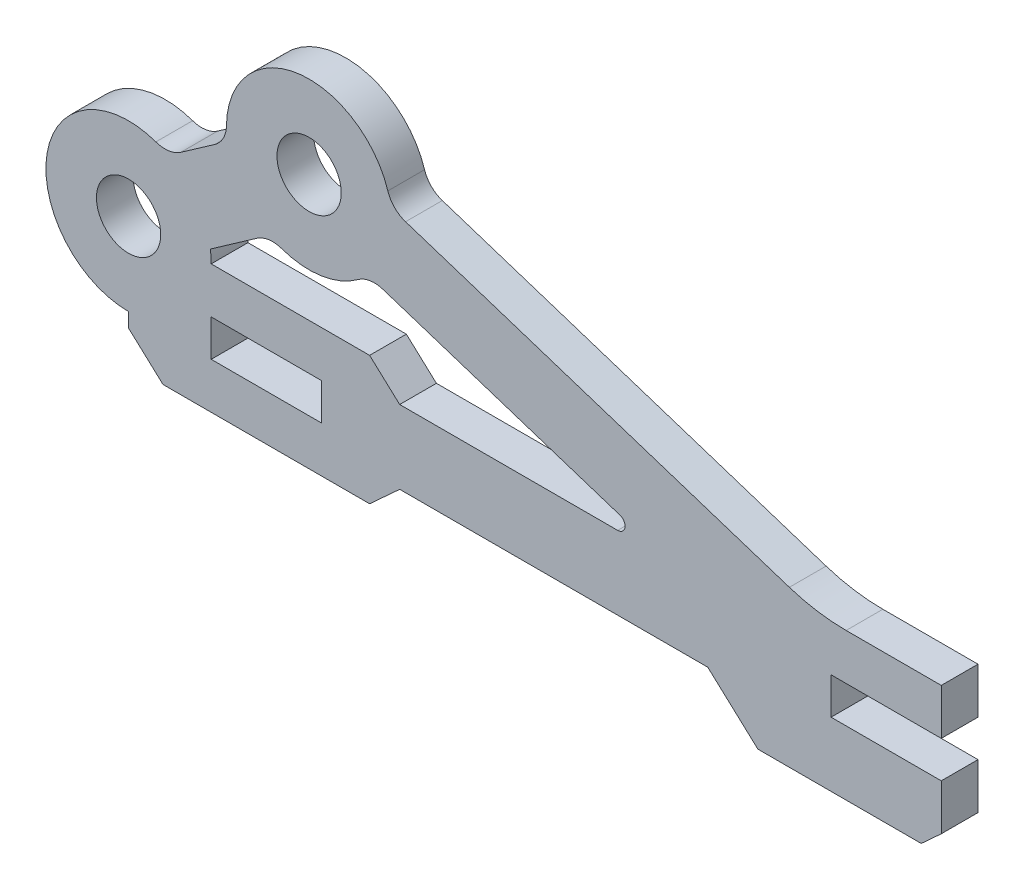
from build123d import *

# Parameters (mm, degrees)
SKETCH1_R           = 1.75
SKETCH1_W           = 6
SKETCH1_H           = 2
BOSS_EXTRUDE1_DEPTH = 2


with BuildPart() as part:
    # Sketch1 → Boss-Extrude1 (new body)
    with BuildSketch(Plane.XY):
        with BuildLine():
            Line((4.690618402, 5.725955542), (2.844900384, 4.433569872))
            ThreePointArc((2.844900384, 4.433569872), (2.189215725, 4.176328188), (1.488401797, 4.246723454))
            ThreePointArc((1.488401797, 4.246723454), (-4.436229003, 0.754898821), (0, -4.5))
            Line((0, -4.5), (0, -5.281879049))
            Line((0, -5.281879049), (1.875, -7))
            Line((1.875, -7), (13.125, -7))
            Line((13.125, -7), (14.761962752, -5.5))
            Line((14.761962752, -5.5), (31.536424497, -5.5))
            Line((31.536424497, -5.5), (34.26469575, -8))
            Line((34.26469575, -8), (43.158691499, -8))
            Line((43.158691499, -8), (44.25, -7))
            Line((44.25, -7), (44.25, -4.5))
            Line((44.25, -4.5), (38.25, -4.5))
            Line((38.25, -4.5), (38.25, -2.5))
            Line((38.25, -2.5), (44.25, -2.5))
            Line((44.25, -2.5), (44.25, 0))
            Line((44.25, 0), (39.069245955, 0))
            ThreePointArc((39.069245955, 0), (37.504901305, 0.123116594), (35.979076012, 0.489434837))
            Line((35.979076012, 0.489434837), (15.082734658, 7.279067722))
            ThreePointArc((15.082734658, 7.279067722), (14.482691436, 7.647908864), (14.117151245, 8.249968682))
            ThreePointArc((14.117151245, 8.249968682), (9.164682181, 11.333488621), (5.330146444, 6.936742015))
            ThreePointArc((5.330146444, 6.936742015), (5.156603875, 6.254115739), (4.690618402, 5.725955542))
        make_face()
        Circle(SKETCH1_R, mode=Mode.SUBTRACT)
        with Locations((9.829824531, 6.882917236)):
            Circle(SKETCH1_R, mode=Mode.SUBTRACT)
        with Locations((7.5, -3.5)):
            Rectangle(SKETCH1_W, SKETCH1_H, mode=Mode.SUBTRACT)
        with BuildLine():
            Line((13.84666668, 3.474841657), (26.75576114, -0.719577393))
            ThreePointArc((26.75576114, -0.719577393), (27.027229678, -1.162573786), (26.632154342, -1.5))
            Line((26.632154342, -1.5), (14.761962752, -1.5))
            Line((14.761962752, -1.5), (13.125, 0))
            Line((13.125, 0), (4.5, 0))
            ThreePointArc((4.5, 0), (4.487297154, 0.337882015), (4.449260331, 0.673856446))
            Line((4.449260331, 0.673856446), (6.984924148, 2.449347365))
            ThreePointArc((6.984924148, 2.449347365), (7.640608806, 2.706589049), (8.341422735, 2.636193783))
            ThreePointArc((8.341422735, 2.636193783), (10.494966882, 2.432345851), (12.494812024, 3.256921971))
            ThreePointArc((12.494812024, 3.256921971), (13.144422133, 3.529139461), (13.84666668, 3.474841657))
        make_face(mode=Mode.SUBTRACT)
    extrude(amount=BOSS_EXTRUDE1_DEPTH)


solid = part.part
